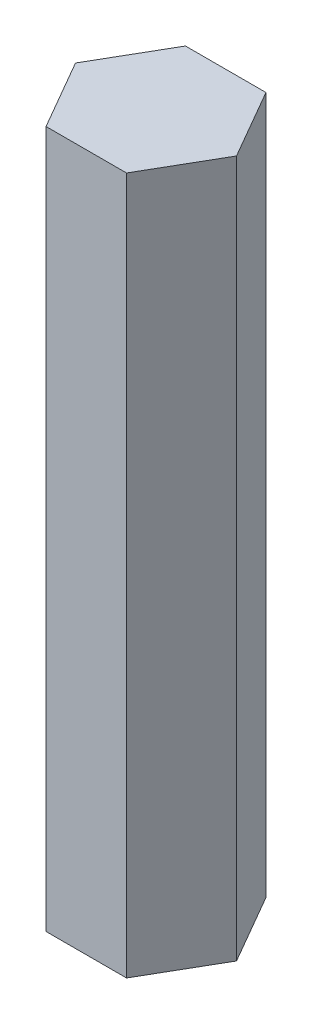
from build123d import *

# Parameters (mm, degrees)
BOSS_EXTRUDE1_DEPTH = 63.5


with BuildPart() as part:
    # Sketch1 → Boss-Extrude1 (new body)
    with BuildSketch(Plane(origin=(0, 0, 0), x_dir=(1, 0, 0), z_dir=(0, 1, 0))):
        Polygon((7.332348419, 0), (3.666174209, 6.35), (-3.666174209, 6.35), (-7.332348419, 0), (-3.666174209, -6.35), (3.666174209, -6.35), align=None)
    extrude(amount=BOSS_EXTRUDE1_DEPTH)


solid = part.part
